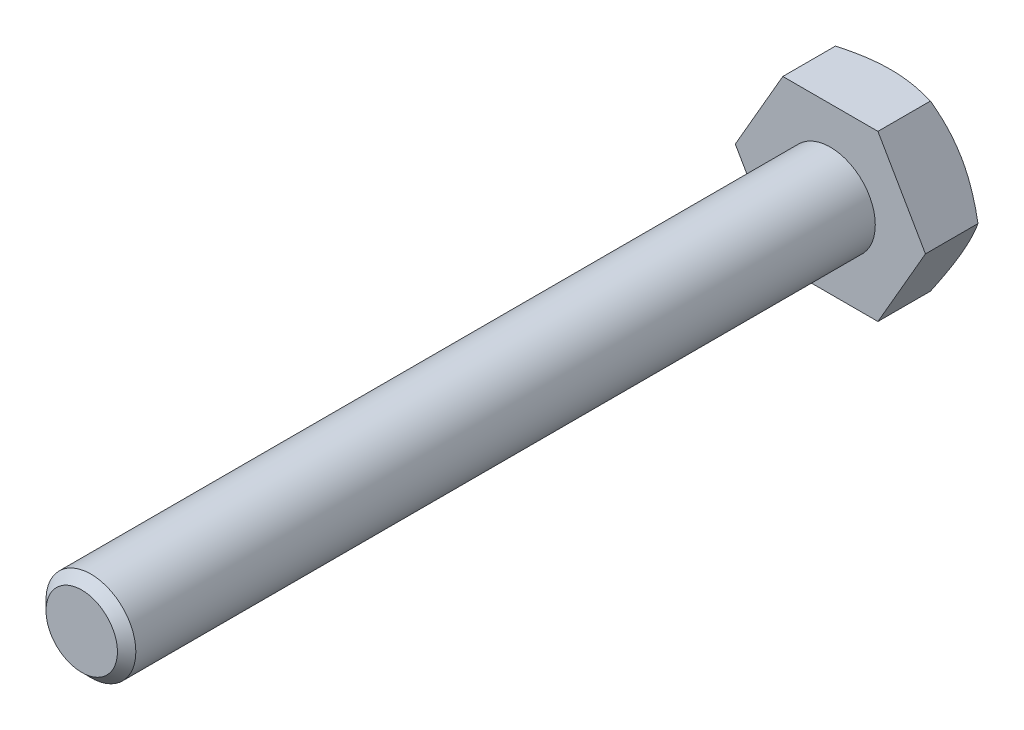
from build123d import *

# Parameters (mm, degrees)
EXTRUDE1_DEPTH = 2
SKETCH2_R      = 1.5
EXTRUDE2_DEPTH = 25
CHAMFER1_SIZE  = 0.307


with BuildPart() as part:
    # Sketch1 → Extrude1 (new body)
    with BuildSketch(Plane.XY):
        Polygon((3.175426481, 0), (1.58771324, 2.75), (-1.58771324, 2.75), (-3.175426481, 0), (-1.58771324, -2.75), (1.58771324, -2.75), align=None)
    extrude(amount=EXTRUDE1_DEPTH)

    # Sketch2 → Extrude2 (add)
    with BuildSketch(Plane.XY.offset(2)):
        Circle(SKETCH2_R)
    extrude(amount=EXTRUDE2_DEPTH)

    # Sketch3 → Cut-Revolve1 (revolve, cut)
    with BuildSketch(Plane(origin=(0, 0, 0), x_dir=(0, 0, -1), z_dir=(1, 0, 0))):
        Polygon((0, 2.75), (0, 102.75), (-57.735026919, 102.75), align=None)
    revolve(axis=Axis((0, 0, 0), (0, 0, -1)), mode=Mode.SUBTRACT)

    # Chamfer1
    chamfer1_edges = [part.edges().sort_by_distance(p)[0] for p in [
        (-1.5, 0, 27),
    ]]
    chamfer(chamfer1_edges, length=CHAMFER1_SIZE)


solid = part.part
